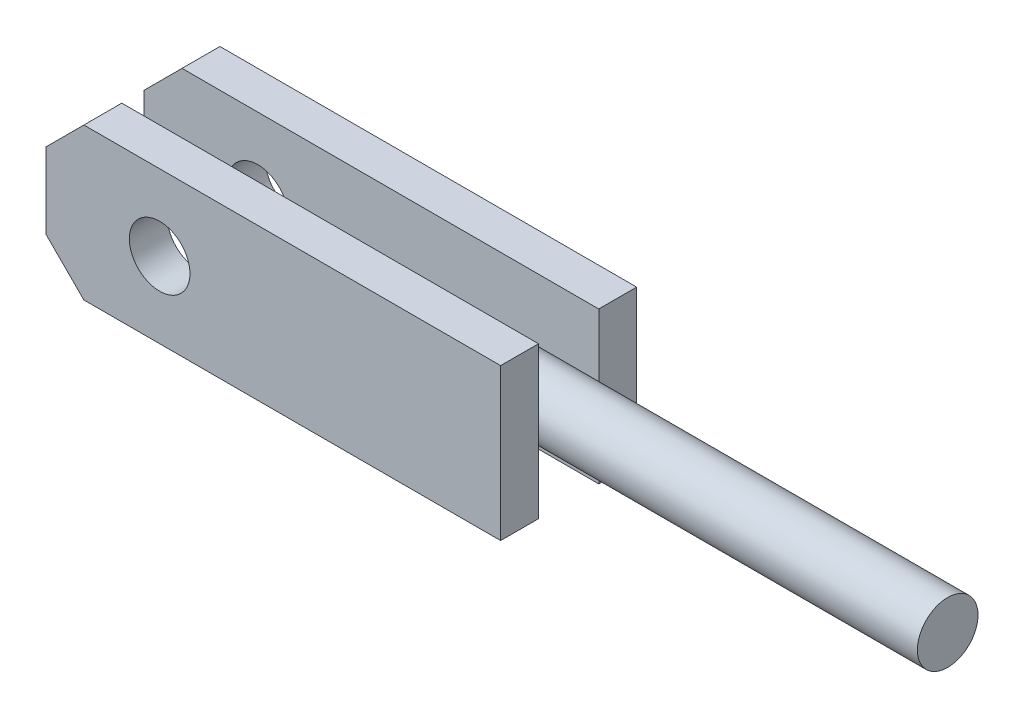
from build123d import *

# Parameters (mm, degrees)
SKETCH1_W                = 120
SKETCH1_H                = 40
BOSS_EXTRUDE1_DEPTH      = 10
SKETCH4_R                = 8
CUT_EXTRUDE1_DEPTH       = 10
CHAMFER2_SIZE            = 10
CHAMFER3_SIZE            = 10
BOSS_EXTRUDE2_DEPTH      = 100
BOSS_EXTRUDE2_DEPTH_BACK = 20
SKETCH5_R                = 8
LPATTERN1_COUNT          = 2
LPATTERN1_PITCH          = 25.9
CHAMFER4_SIZE            = 10
CHAMFER5_SIZE            = 10
CUT_EXTRUDE2_START       = -100
SKETCH6_R                = 8
CUT_EXTRUDE2_DEPTH       = 100


with BuildPart() as part:
    # Sketch1 → Boss-Extrude1 (new body)
    with BuildSketch(Plane.XY):
        Rectangle(SKETCH1_W, SKETCH1_H)
    boss_extrude1 = extrude(amount=BOSS_EXTRUDE1_DEPTH)

    # Sketch4 → Cut-Extrude1 (cut)
    with BuildSketch(Plane.XY.offset(10)):
        with Locations((-30, 0)):
            Circle(SKETCH4_R)
    extrude(amount=-CUT_EXTRUDE1_DEPTH, mode=Mode.SUBTRACT)

    # Chamfer2
    chamfer2_edges = [part.edges().sort_by_distance(p)[0] for p in [
        (-60, 20, 5),
    ]]
    chamfer(chamfer2_edges, length=CHAMFER2_SIZE)

    # Chamfer3
    chamfer3_edges = [part.edges().sort_by_distance(p)[0] for p in [
        (-60, -20, 5),
    ]]
    chamfer(chamfer3_edges, length=CHAMFER3_SIZE)


with BuildPart() as body_2:
    # Sketch5 → Boss-Extrude2 (new, two sides: drawn at the far end of the back side and taken through both)
    with BuildSketch(Plane(origin=(60, 0, 0), x_dir=(0, 0, -1), z_dir=(1, 0, 0)).offset(-BOSS_EXTRUDE2_DEPTH_BACK)):
        with Locations((8, 0)):
            Circle(SKETCH5_R)
    extrude(amount=BOSS_EXTRUDE2_DEPTH + BOSS_EXTRUDE2_DEPTH_BACK)

    # LPattern1: Boss-Extrude1 ×2
    with Locations(*[(0, 0, -i * LPATTERN1_PITCH) for i in range(1, LPATTERN1_COUNT)]):
        add(boss_extrude1)

    # Chamfer4
    chamfer4_edges = [body_2.edges().sort_by_distance(p)[0] for p in [
        (-60, 20, -20.9),
    ]]
    chamfer(chamfer4_edges, length=CHAMFER4_SIZE)

    # Chamfer5
    chamfer5_edges = [body_2.edges().sort_by_distance(p)[0] for p in [
        (-60, -20, -20.9),
    ]]
    chamfer(chamfer5_edges, length=CHAMFER5_SIZE)

    # Sketch6 → Cut-Extrude2 (cut)
    with BuildSketch(Plane(origin=(0, 0, -25.9), x_dir=(-1, 0, 0), z_dir=(0, 0, -1)).offset(CUT_EXTRUDE2_START)):
        with Locations((30, 0)):
            Circle(SKETCH6_R)
    extrude(amount=CUT_EXTRUDE2_DEPTH, mode=Mode.SUBTRACT)


solid = Compound([part.part, body_2.part])
